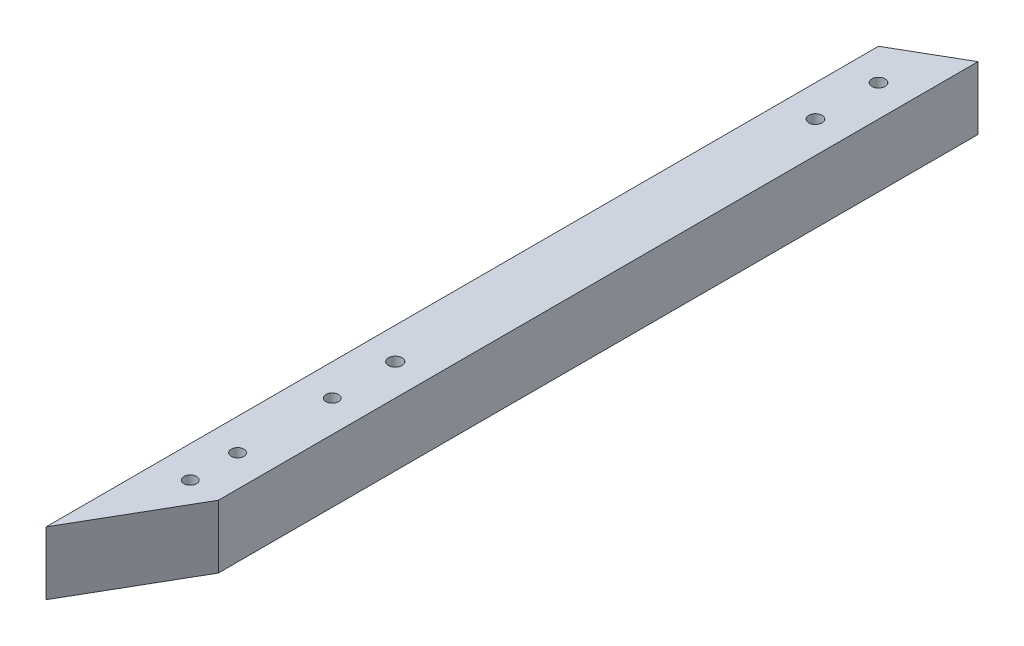
from build123d import *

# Parameters (mm, degrees)
SKETCH_1_W               = 20
SKETCH_1_H               = 20
EXTRUDE_1_DEPTH          = 275.47
CUT_EXTRUDE_1_DEPTH      = 263.92
CUT_EXTRUDE_2_DEPTH      = 277.918256711
CUT_EXTRUDE_2_DEPTH_BACK = 277.918256711
SKETCH_3_R               = 2
SKETCH_3_R_2             = 2.15
SKETCH_4_R               = 2.1
CUT_EXTRUDE_3_DEPTH      = 60


with BuildPart() as part:
    # 草图1 → 凸台-拉伸1 (new body)
    with BuildSketch(Plane.XY):
        with Locations((10, 10)):
            Rectangle(SKETCH_1_W, SKETCH_1_H)
    extrude(amount=EXTRUDE_1_DEPTH)

    # 草图2 → 切除-拉伸1 (cut)
    with BuildSketch(Plane(origin=(0, 20, 0), x_dir=(1, 0, 0), z_dir=(0, 1, 0))):
        Polygon((0, -275.47), (20, -240.828983849), (20, -275.47), align=None)
        Polygon((20, 0), (0, -11.547005384), (0, 0), align=None)
    extrude(amount=-CUT_EXTRUDE_1_DEPTH, mode=Mode.SUBTRACT)

    # 草图3 → 切除-拉伸2 (cut, two sides: drawn at the far end of the back side and taken through both)
    with BuildSketch(Plane.XZ.offset(-CUT_EXTRUDE_2_DEPTH_BACK)):
        with Locations(Location((10, 239.74, 0), (0, 0, 270))):
            Circle(SKETCH_3_R)
        with Locations(Location((10, 224.74, 0), (0, 0, 270))):
            Circle(SKETCH_3_R)
        with Locations(Location((10, 194.74, 0), (0, 0, 270))):
            Circle(SKETCH_3_R)
        with Locations(Location((10, 174.74, 0), (0, 0, 270))):
            Circle(SKETCH_3_R_2)
    extrude(amount=CUT_EXTRUDE_2_DEPTH + CUT_EXTRUDE_2_DEPTH_BACK, mode=Mode.SUBTRACT)

    # 草图4 → 切除-拉伸3 (cut)
    with BuildSketch(Plane.XZ):
        with Locations(Location((10, 21.547005384, 0), (0, 0, 270))):
            Circle(SKETCH_4_R)
        with Locations(Location((10, 41.547005384, 0), (0, 0, 270))):
            Circle(SKETCH_4_R)
    extrude(amount=-CUT_EXTRUDE_3_DEPTH, mode=Mode.SUBTRACT)


solid = part.part
